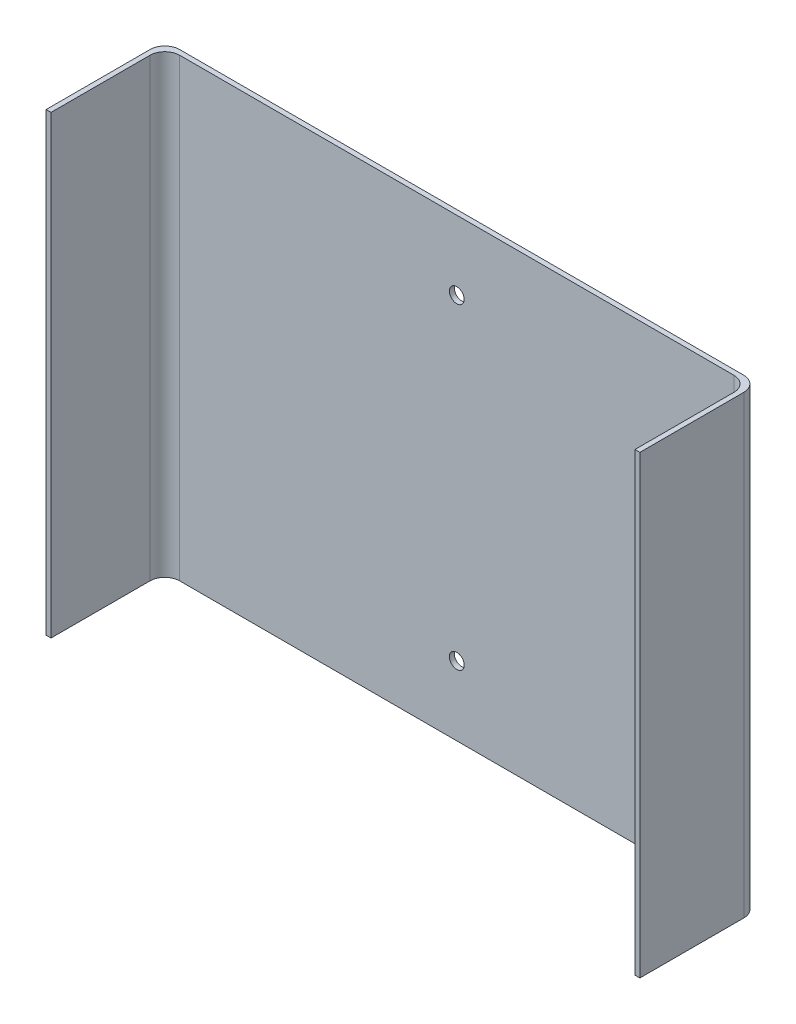
from build123d import *

# Parameters (mm, degrees)
SKETCH1_W           = 120
SKETCH1_H           = 92
SKETCH1_R           = 1.5
BOSS_EXTRUDE1_DEPTH = 1
SKETCH2_W           = 1
SKETCH2_H           = 92
BOSS_EXTRUDE2_DEPTH = 23
FILLET1_R           = 3
FILLET2_R           = 3
FILLET3_R           = 3


with BuildPart() as part:
    # Sketch1 → Boss-Extrude1 (new body)
    with BuildSketch(Plane.XY):
        Rectangle(SKETCH1_W, SKETCH1_H)
        with Locations((0, -32)):
            Circle(SKETCH1_R, mode=Mode.SUBTRACT)
        with Locations(Location((0, 32, 0), (0, 0, 180))):
            Circle(SKETCH1_R, mode=Mode.SUBTRACT)
    extrude(amount=BOSS_EXTRUDE1_DEPTH)

    # Sketch2 → Boss-Extrude2 (add)
    with BuildSketch(Plane.XY.offset(1)):
        with Locations((-59.5, 0)):
            Rectangle(SKETCH2_W, SKETCH2_H)
    boss_extrude2 = extrude(amount=BOSS_EXTRUDE2_DEPTH)

    # Fillet1
    fillet1_edges = [part.edges().sort_by_distance(p)[0] for p in [
        (-60, 0, 0),
    ]]
    fillet(fillet1_edges, radius=FILLET1_R)

    # Fillet2
    fillet2_edges = [part.edges().sort_by_distance(p)[0] for p in [
        (-59, 0, 1),
    ]]
    fillet(fillet2_edges, radius=FILLET2_R)

    # Mirror3: Boss-Extrude2 across plane
    add(boss_extrude2.mirror(Plane(origin=(0, 0, 0), x_dir=(0, 0, 1), z_dir=(1, 0, 0))))

    # Fillet3
    fillet3_edges = [part.edges().sort_by_distance(p)[0] for p in [
        (59, 0, 1),
        (60, 0, 0),
    ]]
    fillet(fillet3_edges, radius=FILLET3_R)


solid = part.part
